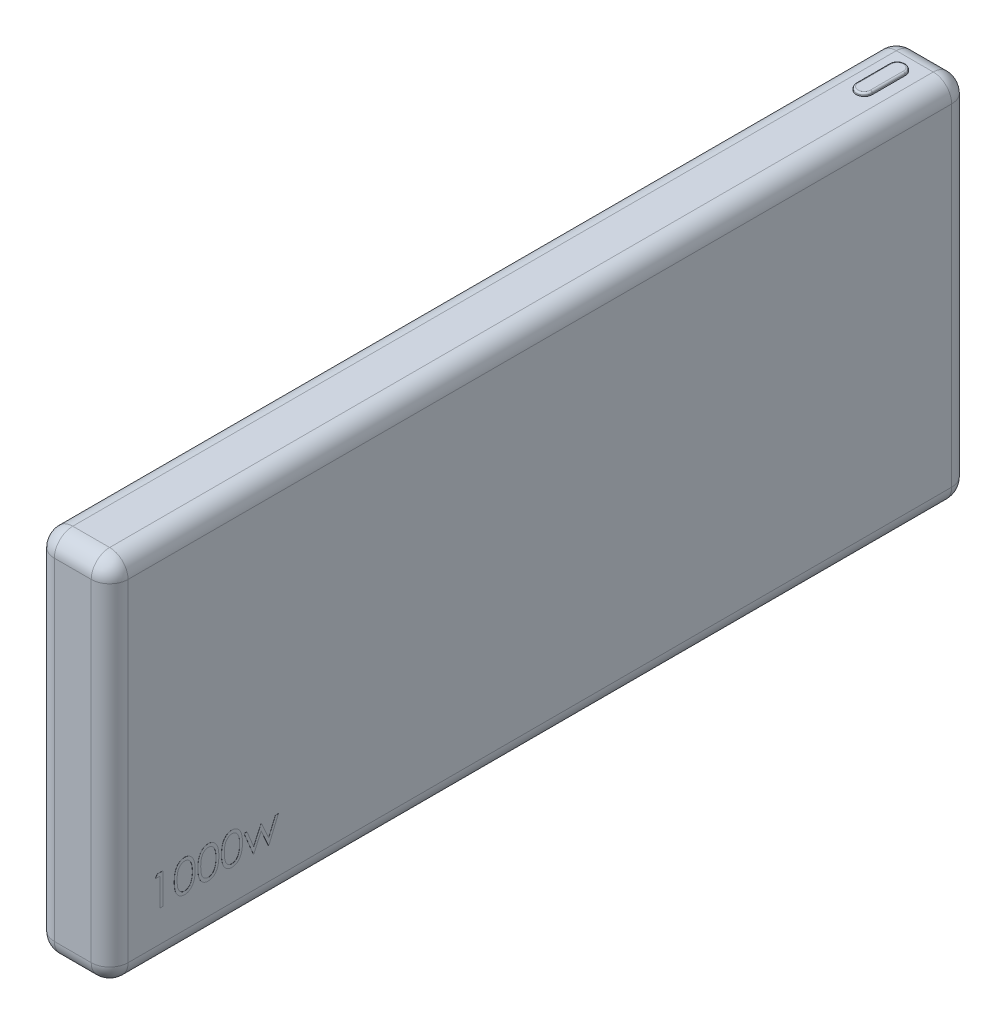
from build123d import *

# Parameters (mm, degrees)
SKETCH2_W           = 14
SKETCH2_H           = 6
BOSS_EXTRUDE1_DEPTH = 1.2
FILLET1_R           = 0.3
CUT_EXTRUDE1_DEPTH  = 0.6
BOSS_EXTRUDE2_DEPTH = 0.4
BOSS_EXTRUDE3_DEPTH = 0.002
SKETCH6_W           = 0.4
SKETCH6_H           = 0.9
CUT_EXTRUDE2_DEPTH  = 0.9
SKETCH7_W           = 0.1
SKETCH7_H           = 0.7
BOSS_EXTRUDE4_DEPTH = 0.7
BOSS_EXTRUDE5_DEPTH = 0.05
FILLET2_R           = 0.03


with BuildPart() as part:
    # Sketch2 → Boss-Extrude1 (new body)
    with BuildSketch(Plane(origin=(0, 0, 0), x_dir=(0, 0, -1), z_dir=(1, 0, 0))):
        Rectangle(SKETCH2_W, SKETCH2_H)
    extrude(amount=BOSS_EXTRUDE1_DEPTH)

    # Fillet1
    fillet1_edges = [part.edges().sort_by_distance(p)[0] for p in [
        (1.2, 0, 7),
        (1.2, -3, 0),
        (1.2, 0, -7),
        (0, -3, 0),
        (0, 0, 7),
        (0, 3, 0),
        (0, 0, -7),
        (0.6, -3, -7),
        (0.6, -3, 7),
        (0.6, 3, 7),
        (0.6, 3, -7),
        (1.2, 3, 0),
    ]]
    fillet(fillet1_edges, radius=FILLET1_R)

    # Sketch3 → Cut-Extrude1 (cut)
    with BuildSketch(Plane(origin=(0, 0, -7), x_dir=(-1, 0, 0), z_dir=(0, 0, -1))):
        with BuildLine():
            Line((-0.45, 2.4), (-0.45, 2.1))
            ThreePointArc((-0.45, 2.1), (-0.6, 1.95), (-0.75, 2.1))
            Line((-0.75, 2.1), (-0.75, 2.4))
            ThreePointArc((-0.75, 2.4), (-0.6, 2.55), (-0.45, 2.4))
        make_face()
        with BuildLine():
            Line((-0.45, 1.4), (-0.45, 1.1))
            ThreePointArc((-0.45, 1.1), (-0.6, 0.95), (-0.75, 1.1))
            Line((-0.75, 1.1), (-0.75, 1.4))
            ThreePointArc((-0.75, 1.4), (-0.6, 1.55), (-0.45, 1.4))
        make_face()
    extrude(amount=-CUT_EXTRUDE1_DEPTH, mode=Mode.SUBTRACT)

    # Sketch4 → Boss-Extrude2 (add)
    with BuildSketch(Plane(origin=(0, 0, -6.4), x_dir=(-1, 0, 0), z_dir=(0, 0, -1))):
        with BuildLine():
            Line((-0.66, 2.4), (-0.66, 2.1))
            ThreePointArc((-0.66, 2.1), (-0.6, 2.04), (-0.54, 2.1))
            Line((-0.54, 2.1), (-0.54, 2.4))
            ThreePointArc((-0.54, 2.4), (-0.6, 2.46), (-0.66, 2.4))
        make_face()
        with BuildLine():
            Line((-0.66, 1.4), (-0.66, 1.1))
            ThreePointArc((-0.66, 1.1), (-0.6, 1.04), (-0.54, 1.1))
            Line((-0.54, 1.1), (-0.54, 1.4))
            ThreePointArc((-0.54, 1.4), (-0.6, 1.46), (-0.66, 1.4))
        make_face()
    extrude(amount=BOSS_EXTRUDE2_DEPTH)

    # Sketch5 → Boss-Extrude3 (add)
    # profile 1 of 5: a face of its own
    with BuildSketch(Plane(origin=(1.2, 0, 0), x_dir=(0, 0, -1), z_dir=(1, 0, 0))):
        Polygon((-6.22794019, -1.687298015), (-6.135492273, -1.687298015), (-6.135492273, -2.187298015), (-6.180364068, -2.187298015), (-6.180364068, -1.738580066), (-6.257287145, -1.738580066), align=None)
    # profile 2 of 5: a face of its own
    with BuildSketch(Plane(origin=(1.2, 0, 0), x_dir=(0, 0, -1), z_dir=(1, 0, 0))):
        with BuildLine():
            add(Edge.make_bspline(
                [(-5.949594837, -1.937498335), (-5.949547977, -1.929484423), (-5.949456952, -1.913917282), (-5.94844432, -1.891233762), (-5.946762128, -1.86995372), (-5.944456789, -1.85007614), (-5.941651364, -1.831595888), (-5.937906294, -1.814562351), (-5.933647322, -1.798896693), (-5.928711259, -1.784547829), (-5.923141575, -1.771322442), (-5.917079537, -1.758975985), (-5.910284567, -1.747527138), (-5.903145008, -1.736793168), (-5.895371855, -1.726949783), (-5.887186313, -1.717857974), (-5.878268902, -1.709727867), (-5.868922758, -1.702321252), (-5.859063263, -1.69582847), (-5.848971454, -1.690109508), (-5.838577867, -1.685223812), (-5.827854127, -1.681382321), (-5.816896619, -1.678209343), (-5.805667038, -1.676039494), (-5.794146843, -1.674674221), (-5.786370923, -1.674543697), (-5.782427369, -1.674477502)],
                knots=[0, 0, 0, 0, 1.646270934, 3.197905019, 4.663502075, 6.030701355, 7.308322542, 8.50163776, 9.611534131, 10.641858119, 11.616356847, 12.558055219, 13.465016945, 14.349605745, 15.204443733, 16.039544428, 16.859896111, 17.680448484, 18.487036065, 19.28249412, 20.06191084, 20.843045899, 21.620316918, 22.403196591, 23.190181807, 24, 24, 24, 24], degree=3))
            add(Edge.make_bspline(
                [(-5.782427369, -1.674477502), (-5.778450872, -1.67454719), (-5.770542871, -1.674685777), (-5.758851389, -1.676017769), (-5.747430006, -1.678227929), (-5.736327415, -1.681359497), (-5.725452416, -1.685244594), (-5.714890072, -1.690114182), (-5.704574775, -1.695782591), (-5.694670448, -1.702443145), (-5.68506836, -1.709869185), (-5.676004366, -1.718263852), (-5.667477639, -1.727542383), (-5.659381167, -1.737605507), (-5.651944653, -1.748646233), (-5.644862734, -1.760472534), (-5.638523872, -1.773291229), (-5.632418918, -1.786888439), (-5.627149349, -1.80164039), (-5.622397028, -1.817463927), (-5.618557175, -1.834545954), (-5.615358708, -1.852796846), (-5.612880866, -1.87228363), (-5.611076202, -1.892964532), (-5.610122905, -1.914853159), (-5.609943376, -1.929818566), (-5.609851247, -1.937498335)],
                knots=[0, 0, 0, 0, 0.810914788, 1.612654377, 2.396697861, 3.181598691, 3.963628158, 4.749916497, 5.551656086, 6.361998678, 7.18212741, 8.025565596, 8.878627764, 9.750805457, 10.657531673, 11.591944965, 12.560506719, 13.57287815, 14.630710178, 15.753379473, 16.941251878, 18.199788006, 19.531962791, 20.947069417, 22.433333509, 24, 24, 24, 24], degree=3))
            add(Edge.make_bspline(
                [(-5.609851247, -1.937498335), (-5.609944331, -1.945144608), (-5.6101257, -1.960043058), (-5.611065516, -1.981833197), (-5.612916749, -2.002404346), (-5.615232461, -2.021805841), (-5.618439742, -2.039956929), (-5.622383337, -2.056920422), (-5.626761954, -2.072769575), (-5.632166925, -2.087374548), (-5.638082741, -2.10093908), (-5.644519197, -2.113605816), (-5.651414887, -2.125486715), (-5.658927565, -2.136486678), (-5.666935195, -2.146683629), (-5.675609165, -2.155897575), (-5.684704963, -2.164350529), (-5.694335308, -2.17187219), (-5.704394101, -2.178455733), (-5.714673969, -2.184343426), (-5.72535731, -2.189090954), (-5.736202017, -2.193167388), (-5.747363212, -2.196281739), (-5.758826982, -2.198435147), (-5.770535016, -2.199945411), (-5.778449525, -2.200060622), (-5.782427369, -2.200118527)],
                knots=[0, 0, 0, 0, 1.561518951, 3.042555995, 4.452378317, 5.7783523, 7.031515105, 8.214008947, 9.334062868, 10.386615937, 11.391082383, 12.354592575, 13.286541444, 14.194233754, 15.072674879, 15.931287219, 16.775624067, 17.606195743, 18.42308326, 19.229000347, 20.022332153, 20.807536673, 21.593273796, 22.3848459, 23.188221202, 24, 24, 24, 24], degree=3))
            add(Edge.make_bspline(
                [(-5.782427369, -2.200118527), (-5.786370814, -2.200051905), (-5.794146518, -2.199920539), (-5.805668293, -2.198561435), (-5.816851499, -2.196376363), (-5.827751321, -2.193316848), (-5.83842368, -2.189571871), (-5.84872315, -2.184692774), (-5.858764247, -2.179073621), (-5.868520184, -2.172674275), (-5.877807636, -2.165342606), (-5.886678865, -2.157233422), (-5.89491101, -2.148144363), (-5.902573024, -2.138218946), (-5.909855037, -2.127548482), (-5.916553519, -2.115987286), (-5.922749355, -2.103581199), (-5.928412711, -2.090250069), (-5.933433948, -2.075799365), (-5.937869335, -2.060063768), (-5.941371358, -2.042904392), (-5.944368923, -2.024459053), (-5.946786692, -2.004648492), (-5.94843731, -1.983461952), (-5.949457498, -1.960912637), (-5.949548222, -1.945445526), (-5.949594837, -1.937498335)],
                knots=[0, 0, 0, 0, 0.810891512, 1.598919785, 2.382837074, 3.152667961, 3.926044502, 4.706494248, 5.493654104, 6.291793342, 7.103789334, 7.925228297, 8.761435821, 9.622817696, 10.50288917, 11.416980706, 12.369136599, 13.353924996, 14.394355917, 15.514179734, 16.714354668, 17.994756427, 19.357759367, 20.818452758, 22.365282078, 24, 24, 24, 24], degree=3))
        make_face()
        with BuildLine():
            add(Edge.make_bspline(
                [(-5.904723042, -1.937298015), (-5.904705978, -1.9439764), (-5.904672861, -1.956937835), (-5.903807689, -1.975772587), (-5.902629085, -1.993339777), (-5.901108899, -2.00966171), (-5.898851335, -2.024683141), (-5.896321794, -2.038507381), (-5.893243496, -2.051061272), (-5.88960135, -2.062430959), (-5.885452908, -2.072809398), (-5.880923499, -2.082466714), (-5.876057681, -2.091516991), (-5.870612088, -2.099878935), (-5.864681365, -2.107579815), (-5.858399471, -2.114755934), (-5.851531959, -2.121155503), (-5.842031424, -2.128830768), (-5.829489071, -2.136762073), (-5.813686148, -2.143668657), (-5.797447798, -2.148009008), (-5.786426191, -2.148560973), (-5.780924965, -2.148836476)],
                knots=[0, 0, 0, 0, 1.459021318, 2.831673884, 4.118529203, 5.306027144, 6.411944654, 7.436330062, 8.375795394, 9.233974572, 10.042671642, 10.816086306, 11.563610507, 12.285937304, 12.993564865, 13.685989202, 14.367179055, 15.041617293, 16.353048772, 17.594441528, 18.799311195, 20, 20, 20, 20], degree=3))
            add(Edge.make_bspline(
                [(-5.780924965, -2.148836476), (-5.775388155, -2.148608222), (-5.764325966, -2.148152184), (-5.748163995, -2.143752365), (-5.732473957, -2.137113859), (-5.720177965, -2.129264215), (-5.710823316, -2.12178874), (-5.704120889, -2.115415219), (-5.697969168, -2.108278666), (-5.692134586, -2.100578767), (-5.686783289, -2.092168412), (-5.681917127, -2.083088044), (-5.677476648, -2.073312447), (-5.674946785, -2.066488199), (-5.673653331, -2.062999136)],
                knots=[0, 0, 0, 0, 1.353760809, 2.704726607, 4.075137775, 5.516104923, 6.260822281, 7.007110065, 7.778089737, 8.566572457, 9.372053459, 10.217411131, 11.088608312, 12, 12, 12, 12], degree=3))
            add(Edge.make_bspline(
                [(-5.673653331, -2.062999136), (-5.672145935, -2.058537745), (-5.669085276, -2.049479207), (-5.665140737, -2.035427257), (-5.662034251, -2.020684005), (-5.659239485, -2.00533756), (-5.657331906, -1.989274745), (-5.655796504, -1.972545262), (-5.65489212, -1.955136496), (-5.654780012, -1.94330864), (-5.654723042, -1.937298015)],
                knots=[0, 0, 0, 0, 0.884706709, 1.796334032, 2.740027952, 3.714592787, 4.726048262, 5.777819803, 6.87074269, 8, 8, 8, 8], degree=3))
            add(Edge.make_bspline(
                [(-5.654723042, -1.937298015), (-5.654801641, -1.931288361), (-5.654955396, -1.919532195), (-5.655543109, -1.902315312), (-5.657060762, -1.885962775), (-5.658746351, -1.870404136), (-5.661231668, -1.855725521), (-5.663911355, -1.841804049), (-5.667511528, -1.828812188), (-5.67135721, -1.816546534), (-5.675758695, -1.80514644), (-5.6806038, -1.794558757), (-5.685778337, -1.784732367), (-5.691398657, -1.775694233), (-5.69739804, -1.76740387), (-5.703934833, -1.760027499), (-5.710749743, -1.753336503), (-5.720295056, -1.745698994), (-5.732791383, -1.737911608), (-5.748340761, -1.730745071), (-5.764522282, -1.726629601), (-5.775461346, -1.72604936), (-5.780924965, -1.725759553)],
                knots=[0, 0, 0, 0, 1.31362396, 2.569729283, 3.763502607, 4.902122613, 5.988968491, 7.01645872, 7.998833611, 8.933434873, 9.825090667, 10.667526885, 11.477055099, 12.250526234, 12.991942729, 13.710640831, 14.402115721, 15.076753259, 16.378508321, 17.609869233, 18.806226677, 20, 20, 20, 20], degree=3))
            add(Edge.make_bspline(
                [(-5.780924965, -1.725759553), (-5.78645505, -1.72604976), (-5.797525294, -1.726630702), (-5.813875001, -1.730729738), (-5.829547052, -1.737874447), (-5.842010334, -1.745724786), (-5.851562303, -1.753201688), (-5.858288402, -1.759685467), (-5.864594998, -1.766777789), (-5.87040467, -1.774549491), (-5.875845996, -1.782901687), (-5.880843283, -1.791900082), (-5.885345759, -1.801590277), (-5.889500693, -1.811964053), (-5.893153948, -1.823332759), (-5.896167372, -1.835871187), (-5.898951236, -1.849651457), (-5.900921989, -1.864754244), (-5.902673954, -1.881080266), (-5.903799861, -1.898691311), (-5.904675755, -1.917557652), (-5.904706964, -1.930586103), (-5.904723042, -1.937298015)],
                knots=[0, 0, 0, 0, 1.207732386, 2.417664972, 3.655092373, 4.956220595, 5.625982001, 6.301752483, 6.994047911, 7.697131622, 8.419323945, 9.170223765, 9.943494443, 10.752040957, 11.610060368, 12.549350801, 13.567764191, 14.679664412, 15.874934091, 17.154273443, 18.533957287, 20, 20, 20, 20], degree=3))
        make_face(mode=Mode.SUBTRACT)
    # profile 3 of 5: a face of its own
    with BuildSketch(Plane(origin=(1.2, 0, 0), x_dir=(0, 0, -1), z_dir=(1, 0, 0))):
        with BuildLine():
            add(Edge.make_bspline(
                [(-5.564979453, -1.937498335), (-5.564932593, -1.929484423), (-5.564841567, -1.913917282), (-5.563828936, -1.891233762), (-5.562146744, -1.86995372), (-5.559841405, -1.85007614), (-5.557035979, -1.831595888), (-5.55329091, -1.814562351), (-5.549031938, -1.798896693), (-5.544095874, -1.784547829), (-5.53852619, -1.771322442), (-5.532464153, -1.758975985), (-5.525669182, -1.747527138), (-5.518529623, -1.736793168), (-5.51075647, -1.726949783), (-5.502570928, -1.717857974), (-5.493653518, -1.709727867), (-5.484307374, -1.702321252), (-5.474447879, -1.69582847), (-5.464356069, -1.690109508), (-5.453962483, -1.685223812), (-5.443238742, -1.681382321), (-5.432281234, -1.678209343), (-5.421051653, -1.676039494), (-5.409531458, -1.674674221), (-5.401755539, -1.674543697), (-5.397811985, -1.674477502)],
                knots=[0, 0, 0, 0, 1.646270934, 3.197905019, 4.663502075, 6.030701355, 7.308322542, 8.50163776, 9.611534131, 10.641858119, 11.616356847, 12.558055219, 13.465016945, 14.349605745, 15.204443733, 16.039544428, 16.859896111, 17.680448484, 18.487036065, 19.28249412, 20.06191084, 20.843045899, 21.620316918, 22.403196591, 23.190181807, 24, 24, 24, 24], degree=3))
            add(Edge.make_bspline(
                [(-5.397811985, -1.674477502), (-5.393835488, -1.67454719), (-5.385927486, -1.674685777), (-5.374236004, -1.676017769), (-5.362814621, -1.678227929), (-5.35171203, -1.681359497), (-5.340837032, -1.685244594), (-5.330274688, -1.690114182), (-5.31995939, -1.695782591), (-5.310055064, -1.702443145), (-5.300452976, -1.709869185), (-5.291388981, -1.718263852), (-5.282862255, -1.727542383), (-5.274765782, -1.737605507), (-5.267329268, -1.748646233), (-5.26024735, -1.760472534), (-5.253908487, -1.773291229), (-5.247803534, -1.786888439), (-5.242533964, -1.80164039), (-5.237781643, -1.817463927), (-5.233941791, -1.834545954), (-5.230743323, -1.852796846), (-5.228265481, -1.87228363), (-5.226460818, -1.892964532), (-5.22550752, -1.914853159), (-5.225327991, -1.929818566), (-5.225235863, -1.937498335)],
                knots=[0, 0, 0, 0, 0.810914788, 1.612654377, 2.396697861, 3.181598691, 3.963628158, 4.749916497, 5.551656086, 6.361998678, 7.18212741, 8.025565596, 8.878627764, 9.750805457, 10.657531673, 11.591944965, 12.560506719, 13.57287815, 14.630710178, 15.753379473, 16.941251878, 18.199788006, 19.531962791, 20.947069417, 22.433333509, 24, 24, 24, 24], degree=3))
            add(Edge.make_bspline(
                [(-5.225235863, -1.937498335), (-5.225328946, -1.945144608), (-5.225510316, -1.960043058), (-5.226450131, -1.981833197), (-5.228301364, -2.002404346), (-5.230617077, -2.021805841), (-5.233824357, -2.039956929), (-5.237767952, -2.056920422), (-5.24214657, -2.072769575), (-5.24755154, -2.087374548), (-5.253467356, -2.10093908), (-5.259903813, -2.113605816), (-5.266799502, -2.125486715), (-5.27431218, -2.136486678), (-5.28231981, -2.146683629), (-5.29099378, -2.155897575), (-5.300089578, -2.164350529), (-5.309719923, -2.17187219), (-5.319778716, -2.178455733), (-5.330058584, -2.184343426), (-5.340741925, -2.189090954), (-5.351586632, -2.193167388), (-5.362747828, -2.196281739), (-5.374211598, -2.198435147), (-5.385919631, -2.199945411), (-5.393834141, -2.200060622), (-5.397811985, -2.200118527)],
                knots=[0, 0, 0, 0, 1.561518951, 3.042555995, 4.452378317, 5.7783523, 7.031515105, 8.214008947, 9.334062868, 10.386615937, 11.391082383, 12.354592575, 13.286541444, 14.194233754, 15.072674879, 15.931287219, 16.775624067, 17.606195743, 18.42308326, 19.229000347, 20.022332153, 20.807536673, 21.593273796, 22.3848459, 23.188221202, 24, 24, 24, 24], degree=3))
            add(Edge.make_bspline(
                [(-5.397811985, -2.200118527), (-5.401755429, -2.200051905), (-5.409531133, -2.199920539), (-5.421052908, -2.198561435), (-5.432236114, -2.196376363), (-5.443135936, -2.193316848), (-5.453808296, -2.189571871), (-5.464107765, -2.184692774), (-5.474148863, -2.179073621), (-5.483904799, -2.172674275), (-5.493192251, -2.165342606), (-5.50206348, -2.157233422), (-5.510295626, -2.148144363), (-5.517957639, -2.138218946), (-5.525239652, -2.127548482), (-5.531938134, -2.115987286), (-5.53813397, -2.103581199), (-5.543797326, -2.090250069), (-5.548818564, -2.075799365), (-5.553253951, -2.060063768), (-5.556755973, -2.042904392), (-5.559753538, -2.024459053), (-5.562171307, -2.004648492), (-5.563821925, -1.983461952), (-5.564842113, -1.960912637), (-5.564932837, -1.945445526), (-5.564979453, -1.937498335)],
                knots=[0, 0, 0, 0, 0.810891512, 1.598919785, 2.382837074, 3.152667961, 3.926044502, 4.706494248, 5.493654104, 6.291793342, 7.103789334, 7.925228297, 8.761435821, 9.622817696, 10.50288917, 11.416980706, 12.369136599, 13.353924996, 14.394355917, 15.514179734, 16.714354668, 17.994756427, 19.357759367, 20.818452758, 22.365282078, 24, 24, 24, 24], degree=3))
        make_face()
        with BuildLine():
            add(Edge.make_bspline(
                [(-5.520107658, -1.937298015), (-5.520090594, -1.9439764), (-5.520057476, -1.956937835), (-5.519192305, -1.975772587), (-5.5180137, -1.993339777), (-5.516493515, -2.00966171), (-5.514235951, -2.024683141), (-5.51170641, -2.038507381), (-5.508628111, -2.051061272), (-5.504985966, -2.062430959), (-5.500837523, -2.072809398), (-5.496308114, -2.082466714), (-5.491442297, -2.091516991), (-5.485996704, -2.099878935), (-5.48006598, -2.107579815), (-5.473784086, -2.114755934), (-5.466916574, -2.121155503), (-5.45741604, -2.128830768), (-5.444873686, -2.136762073), (-5.429070764, -2.143668657), (-5.412832414, -2.148009008), (-5.401810807, -2.148560973), (-5.396309581, -2.148836476)],
                knots=[0, 0, 0, 0, 1.459021318, 2.831673884, 4.118529203, 5.306027144, 6.411944654, 7.436330062, 8.375795394, 9.233974572, 10.042671642, 10.816086306, 11.563610507, 12.285937304, 12.993564865, 13.685989202, 14.367179055, 15.041617293, 16.353048772, 17.594441528, 18.799311195, 20, 20, 20, 20], degree=3))
            add(Edge.make_bspline(
                [(-5.396309581, -2.148836476), (-5.390772771, -2.148608222), (-5.379710581, -2.148152184), (-5.363548611, -2.143752365), (-5.347858572, -2.137113859), (-5.335562581, -2.129264215), (-5.326207932, -2.12178874), (-5.319505504, -2.115415219), (-5.313353783, -2.108278666), (-5.307519201, -2.100578767), (-5.302167905, -2.092168412), (-5.297301742, -2.083088044), (-5.292861264, -2.073312447), (-5.2903314, -2.066488199), (-5.289037946, -2.062999136)],
                knots=[0, 0, 0, 0, 1.353760809, 2.704726607, 4.075137775, 5.516104923, 6.260822281, 7.007110065, 7.778089737, 8.566572457, 9.372053459, 10.217411131, 11.088608312, 12, 12, 12, 12], degree=3))
            add(Edge.make_bspline(
                [(-5.289037946, -2.062999136), (-5.287530551, -2.058537745), (-5.284469892, -2.049479207), (-5.280525352, -2.035427257), (-5.277418867, -2.020684005), (-5.2746241, -2.00533756), (-5.272716521, -1.989274745), (-5.271181119, -1.972545262), (-5.270276735, -1.955136496), (-5.270164628, -1.94330864), (-5.270107658, -1.937298015)],
                knots=[0, 0, 0, 0, 0.884706709, 1.796334032, 2.740027952, 3.714592787, 4.726048262, 5.777819803, 6.87074269, 8, 8, 8, 8], degree=3))
            add(Edge.make_bspline(
                [(-5.270107658, -1.937298015), (-5.270186256, -1.931288361), (-5.270340012, -1.919532195), (-5.270927724, -1.902315312), (-5.272445378, -1.885962775), (-5.274130966, -1.870404136), (-5.276616283, -1.855725521), (-5.27929597, -1.841804049), (-5.282896143, -1.828812188), (-5.286741825, -1.816546534), (-5.29114331, -1.80514644), (-5.295988415, -1.794558757), (-5.301162952, -1.784732367), (-5.306783272, -1.775694233), (-5.312782656, -1.76740387), (-5.319319448, -1.760027499), (-5.326134359, -1.753336503), (-5.335679671, -1.745698994), (-5.348175998, -1.737911608), (-5.363725376, -1.730745071), (-5.379906897, -1.726629601), (-5.390845962, -1.72604936), (-5.396309581, -1.725759553)],
                knots=[0, 0, 0, 0, 1.31362396, 2.569729283, 3.763502607, 4.902122613, 5.988968491, 7.01645872, 7.998833611, 8.933434873, 9.825090667, 10.667526885, 11.477055099, 12.250526234, 12.991942729, 13.710640831, 14.402115721, 15.076753259, 16.378508321, 17.609869233, 18.806226677, 20, 20, 20, 20], degree=3))
            add(Edge.make_bspline(
                [(-5.396309581, -1.725759553), (-5.401839665, -1.72604976), (-5.412909909, -1.726630702), (-5.429259617, -1.730729738), (-5.444931667, -1.737874447), (-5.457394949, -1.745724786), (-5.466946919, -1.753201688), (-5.473673018, -1.759685467), (-5.479979614, -1.766777789), (-5.485789285, -1.774549491), (-5.491230611, -1.782901687), (-5.496227899, -1.791900082), (-5.500730375, -1.801590277), (-5.504885308, -1.811964053), (-5.508538564, -1.823332759), (-5.511551987, -1.835871187), (-5.514335852, -1.849651457), (-5.516306604, -1.864754244), (-5.51805857, -1.881080266), (-5.519184476, -1.898691311), (-5.52006037, -1.917557652), (-5.52009158, -1.930586103), (-5.520107658, -1.937298015)],
                knots=[0, 0, 0, 0, 1.207732386, 2.417664972, 3.655092373, 4.956220595, 5.625982001, 6.301752483, 6.994047911, 7.697131622, 8.419323945, 9.170223765, 9.943494443, 10.752040957, 11.610060368, 12.549350801, 13.567764191, 14.679664412, 15.874934091, 17.154273443, 18.533957287, 20, 20, 20, 20], degree=3))
        make_face(mode=Mode.SUBTRACT)
    # profile 4 of 5: a face of its own
    with BuildSketch(Plane(origin=(1.2, 0, 0), x_dir=(0, 0, -1), z_dir=(1, 0, 0))):
        with BuildLine():
            add(Edge.make_bspline(
                [(-5.180364068, -1.937498335), (-5.180317208, -1.929484423), (-5.180226182, -1.913917282), (-5.179213551, -1.891233762), (-5.177531359, -1.86995372), (-5.17522602, -1.85007614), (-5.172420594, -1.831595888), (-5.168675525, -1.814562351), (-5.164416553, -1.798896693), (-5.159480489, -1.784547829), (-5.153910805, -1.771322442), (-5.147848768, -1.758975985), (-5.141053797, -1.747527138), (-5.133914238, -1.736793168), (-5.126141085, -1.726949783), (-5.117955544, -1.717857974), (-5.109038133, -1.709727867), (-5.099691989, -1.702321252), (-5.089832494, -1.69582847), (-5.079740685, -1.690109508), (-5.069347098, -1.685223812), (-5.058623358, -1.681382321), (-5.047665849, -1.678209343), (-5.036436268, -1.676039494), (-5.024916074, -1.674674221), (-5.017140154, -1.674543697), (-5.0131966, -1.674477502)],
                knots=[0, 0, 0, 0, 1.646270934, 3.197905019, 4.663502075, 6.030701355, 7.308322542, 8.50163776, 9.611534131, 10.641858119, 11.616356847, 12.558055219, 13.465016945, 14.349605745, 15.204443733, 16.039544428, 16.859896111, 17.680448484, 18.487036065, 19.28249412, 20.06191084, 20.843045899, 21.620316918, 22.403196591, 23.190181807, 24, 24, 24, 24], degree=3))
            add(Edge.make_bspline(
                [(-5.0131966, -1.674477502), (-5.009220103, -1.67454719), (-5.001312102, -1.674685777), (-4.98962062, -1.676017769), (-4.978199237, -1.678227929), (-4.967096645, -1.681359497), (-4.956221647, -1.685244594), (-4.945659303, -1.690114182), (-4.935344006, -1.695782591), (-4.925439679, -1.702443145), (-4.915837591, -1.709869185), (-4.906773596, -1.718263852), (-4.89824687, -1.727542383), (-4.890150398, -1.737605507), (-4.882713884, -1.748646233), (-4.875631965, -1.760472534), (-4.869293103, -1.773291229), (-4.863188149, -1.786888439), (-4.85791858, -1.80164039), (-4.853166259, -1.817463927), (-4.849326406, -1.834545954), (-4.846127939, -1.852796846), (-4.843650096, -1.87228363), (-4.841845433, -1.892964532), (-4.840892135, -1.914853159), (-4.840712607, -1.929818566), (-4.840620478, -1.937498335)],
                knots=[0, 0, 0, 0, 0.810914788, 1.612654377, 2.396697861, 3.181598691, 3.963628158, 4.749916497, 5.551656086, 6.361998678, 7.18212741, 8.025565596, 8.878627764, 9.750805457, 10.657531673, 11.591944965, 12.560506719, 13.57287815, 14.630710178, 15.753379473, 16.941251878, 18.199788006, 19.531962791, 20.947069417, 22.433333509, 24, 24, 24, 24], degree=3))
            add(Edge.make_bspline(
                [(-4.840620478, -1.937498335), (-4.840713562, -1.945144608), (-4.840894931, -1.960043058), (-4.841834746, -1.981833197), (-4.843685979, -2.002404346), (-4.846001692, -2.021805841), (-4.849208972, -2.039956929), (-4.853152568, -2.056920422), (-4.857531185, -2.072769575), (-4.862936156, -2.087374548), (-4.868851972, -2.10093908), (-4.875288428, -2.113605816), (-4.882184118, -2.125486715), (-4.889696795, -2.136486678), (-4.897704426, -2.146683629), (-4.906378396, -2.155897575), (-4.915474194, -2.164350529), (-4.925104539, -2.17187219), (-4.935163332, -2.178455733), (-4.9454432, -2.184343426), (-4.95612654, -2.189090954), (-4.966971248, -2.193167388), (-4.978132443, -2.196281739), (-4.989596213, -2.198435147), (-5.001304247, -2.199945411), (-5.009218756, -2.200060622), (-5.0131966, -2.200118527)],
                knots=[0, 0, 0, 0, 1.561518951, 3.042555995, 4.452378317, 5.7783523, 7.031515105, 8.214008947, 9.334062868, 10.386615937, 11.391082383, 12.354592575, 13.286541444, 14.194233754, 15.072674879, 15.931287219, 16.775624067, 17.606195743, 18.42308326, 19.229000347, 20.022332153, 20.807536673, 21.593273796, 22.3848459, 23.188221202, 24, 24, 24, 24], degree=3))
            add(Edge.make_bspline(
                [(-5.0131966, -2.200118527), (-5.017140045, -2.200051905), (-5.024915748, -2.199920539), (-5.036437523, -2.198561435), (-5.04762073, -2.196376363), (-5.058520552, -2.193316848), (-5.069192911, -2.189571871), (-5.07949238, -2.184692774), (-5.089533478, -2.179073621), (-5.099289415, -2.172674275), (-5.108576866, -2.165342606), (-5.117448096, -2.157233422), (-5.125680241, -2.148144363), (-5.133342255, -2.138218946), (-5.140624267, -2.127548482), (-5.147322749, -2.115987286), (-5.153518586, -2.103581199), (-5.159181941, -2.090250069), (-5.164203179, -2.075799365), (-5.168638566, -2.060063768), (-5.172140588, -2.042904392), (-5.175138154, -2.024459053), (-5.177555923, -2.004648492), (-5.17920654, -1.983461952), (-5.180226728, -1.960912637), (-5.180317453, -1.945445526), (-5.180364068, -1.937498335)],
                knots=[0, 0, 0, 0, 0.810891512, 1.598919785, 2.382837074, 3.152667961, 3.926044502, 4.706494248, 5.493654104, 6.291793342, 7.103789334, 7.925228297, 8.761435821, 9.622817696, 10.50288917, 11.416980706, 12.369136599, 13.353924996, 14.394355917, 15.514179734, 16.714354668, 17.994756427, 19.357759367, 20.818452758, 22.365282078, 24, 24, 24, 24], degree=3))
        make_face()
        with BuildLine():
            add(Edge.make_bspline(
                [(-5.135492273, -1.937298015), (-5.135475209, -1.9439764), (-5.135442092, -1.956937835), (-5.13457692, -1.975772587), (-5.133398316, -1.993339777), (-5.13187813, -2.00966171), (-5.129620566, -2.024683141), (-5.127091025, -2.038507381), (-5.124012726, -2.051061272), (-5.120370581, -2.062430959), (-5.116222139, -2.072809398), (-5.11169273, -2.082466714), (-5.106826912, -2.091516991), (-5.101381319, -2.099878935), (-5.095450596, -2.107579815), (-5.089168702, -2.114755934), (-5.08230119, -2.121155503), (-5.072800655, -2.128830768), (-5.060258301, -2.136762073), (-5.044455379, -2.143668657), (-5.028217029, -2.148009008), (-5.017195422, -2.148560973), (-5.011694196, -2.148836476)],
                knots=[0, 0, 0, 0, 1.459021318, 2.831673884, 4.118529203, 5.306027144, 6.411944654, 7.436330062, 8.375795394, 9.233974572, 10.042671642, 10.816086306, 11.563610507, 12.285937304, 12.993564865, 13.685989202, 14.367179055, 15.041617293, 16.353048772, 17.594441528, 18.799311195, 20, 20, 20, 20], degree=3))
            add(Edge.make_bspline(
                [(-5.011694196, -2.148836476), (-5.006157386, -2.148608222), (-4.995095197, -2.148152184), (-4.978933226, -2.143752365), (-4.963243188, -2.137113859), (-4.950947196, -2.129264215), (-4.941592547, -2.12178874), (-4.93489012, -2.115415219), (-4.928738399, -2.108278666), (-4.922903817, -2.100578767), (-4.91755252, -2.092168412), (-4.912686357, -2.083088044), (-4.908245879, -2.073312447), (-4.905716016, -2.066488199), (-4.904422562, -2.062999136)],
                knots=[0, 0, 0, 0, 1.353760809, 2.704726607, 4.075137775, 5.516104923, 6.260822281, 7.007110065, 7.778089737, 8.566572457, 9.372053459, 10.217411131, 11.088608312, 12, 12, 12, 12], degree=3))
            add(Edge.make_bspline(
                [(-4.904422562, -2.062999136), (-4.902915166, -2.058537745), (-4.899854507, -2.049479207), (-4.895909968, -2.035427257), (-4.892803482, -2.020684005), (-4.890008716, -2.00533756), (-4.888101136, -1.989274745), (-4.886565734, -1.972545262), (-4.885661351, -1.955136496), (-4.885549243, -1.94330864), (-4.885492273, -1.937298015)],
                knots=[0, 0, 0, 0, 0.884706709, 1.796334032, 2.740027952, 3.714592787, 4.726048262, 5.777819803, 6.87074269, 8, 8, 8, 8], degree=3))
            add(Edge.make_bspline(
                [(-4.885492273, -1.937298015), (-4.885570872, -1.931288361), (-4.885724627, -1.919532195), (-4.886312339, -1.902315312), (-4.887829993, -1.885962775), (-4.889515581, -1.870404136), (-4.892000899, -1.855725521), (-4.894680585, -1.841804049), (-4.898280759, -1.828812188), (-4.902126441, -1.816546534), (-4.906527926, -1.80514644), (-4.911373031, -1.794558757), (-4.916547568, -1.784732367), (-4.922167888, -1.775694233), (-4.928167271, -1.76740387), (-4.934704064, -1.760027499), (-4.941518974, -1.753336503), (-4.951064286, -1.745698994), (-4.963560613, -1.737911608), (-4.979109992, -1.730745071), (-4.995291512, -1.726629601), (-5.006230577, -1.72604936), (-5.011694196, -1.725759553)],
                knots=[0, 0, 0, 0, 1.31362396, 2.569729283, 3.763502607, 4.902122613, 5.988968491, 7.01645872, 7.998833611, 8.933434873, 9.825090667, 10.667526885, 11.477055099, 12.250526234, 12.991942729, 13.710640831, 14.402115721, 15.076753259, 16.378508321, 17.609869233, 18.806226677, 20, 20, 20, 20], degree=3))
            add(Edge.make_bspline(
                [(-5.011694196, -1.725759553), (-5.017224281, -1.72604976), (-5.028294524, -1.726630702), (-5.044644232, -1.730729738), (-5.060316282, -1.737874447), (-5.072779565, -1.745724786), (-5.082331534, -1.753201688), (-5.089057633, -1.759685467), (-5.095364229, -1.766777789), (-5.101173901, -1.774549491), (-5.106615227, -1.782901687), (-5.111612514, -1.791900082), (-5.11611499, -1.801590277), (-5.120269924, -1.811964053), (-5.123923179, -1.823332759), (-5.126936602, -1.835871187), (-5.129720467, -1.849651457), (-5.13169122, -1.864754244), (-5.133443185, -1.881080266), (-5.134569092, -1.898691311), (-5.135444986, -1.917557652), (-5.135476195, -1.930586103), (-5.135492273, -1.937298015)],
                knots=[0, 0, 0, 0, 1.207732386, 2.417664972, 3.655092373, 4.956220595, 5.625982001, 6.301752483, 6.994047911, 7.697131622, 8.419323945, 9.170223765, 9.943494443, 10.752040957, 11.610060368, 12.549350801, 13.567764191, 14.679664412, 15.874934091, 17.154273443, 18.533957287, 20, 20, 20, 20], degree=3))
        make_face(mode=Mode.SUBTRACT)
    # profile 5 of 5: a face of its own
    with BuildSketch(Plane(origin=(1.2, 0, 0), x_dir=(0, 0, -1), z_dir=(1, 0, 0))):
        Polygon((-4.814979453, -1.821913399), (-4.766802369, -1.821913399), (-4.657928171, -2.084733912), (-4.538637305, -1.821913399), (-4.531025126, -1.821913399), (-4.414338427, -2.084733912), (-4.304462626, -1.821913399), (-4.257287145, -1.821913399), (-4.410031536, -2.187298015), (-4.41934644, -2.187298015), (-4.536133299, -1.924477502), (-4.655324004, -2.187298015), (-4.663637305, -2.187298015), align=None)
    extrude(amount=BOSS_EXTRUDE3_DEPTH)

    # Sketch6 → Cut-Extrude2 (cut)
    with BuildSketch(Plane(origin=(0, 0, -7), x_dir=(-1, 0, 0), z_dir=(0, 0, -1))):
        with Locations((-0.6, 0.04)):
            Rectangle(SKETCH6_W, SKETCH6_H)
        with Locations((-0.6, -1.46)):
            Rectangle(SKETCH6_W, SKETCH6_H)
    extrude(amount=-CUT_EXTRUDE2_DEPTH, mode=Mode.SUBTRACT)

    # Sketch7 → Boss-Extrude4 (add)
    with BuildSketch(Plane(origin=(0, 0, -6.1), x_dir=(-1, 0, 0), z_dir=(0, 0, -1))):
        with Locations((-0.55, 0.04)):
            Rectangle(SKETCH7_W, SKETCH7_H)
        with Locations((-0.55, -1.46)):
            Rectangle(SKETCH7_W, SKETCH7_H)
    extrude(amount=BOSS_EXTRUDE4_DEPTH)

    # Sketch8 → Boss-Extrude5 (add)
    with BuildSketch(Plane(origin=(0, 3, 0), x_dir=(1, 0, 0), z_dir=(0, 1, 0))):
        with BuildLine():
            Line((0.723475583, 6.420341504), (0.723475583, 5.88458325))
            ThreePointArc((0.723475583, 5.88458325), (0.593362864, 5.754470531), (0.463250145, 5.88458325))
            Line((0.463250145, 5.88458325), (0.463250145, 6.420341504))
            ThreePointArc((0.463250145, 6.420341504), (0.593362864, 6.550454223), (0.723475583, 6.420341504))
        make_face()
    extrude(amount=BOSS_EXTRUDE5_DEPTH)

    # Fillet2
    fillet2_edges = [part.edges().sort_by_distance(p)[0] for p in [
        (0.593362864, 3.05, -6.550454223),
        (0.463250145, 3.05, -6.152462377),
        (0.593362864, 3.05, -5.754470531),
        (0.723475583, 3.05, -6.152462377),
    ]]
    fillet(fillet2_edges, radius=FILLET2_R)


solid = part.part
